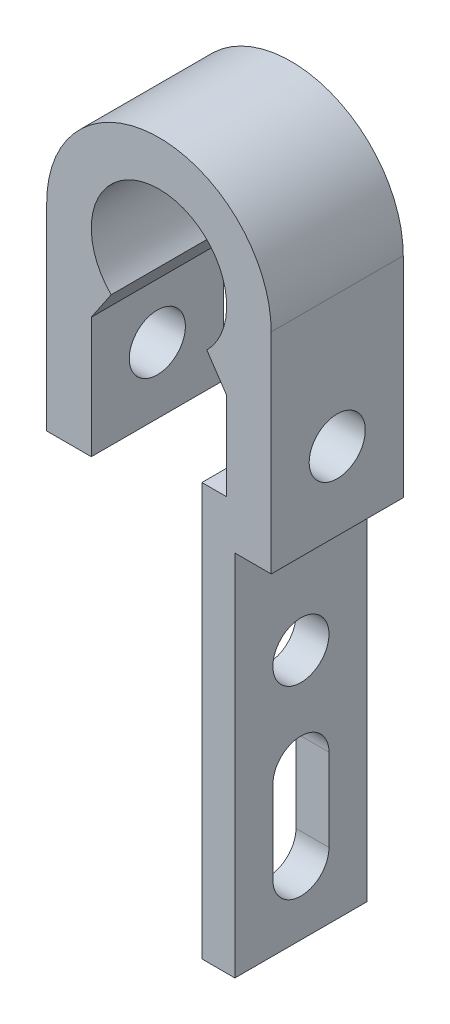
from build123d import *

# Parameters (mm, degrees)
RESSALTO_EXTRUS_O1_DEPTH = 8
ESBO_O2_R                = 1.7
CORTE_EXTRUS_O1_DEPTH    = 39.392186705


with BuildPart() as part:
    # Esboço1 → Ressalto-extrusão1 (new body)
    with BuildSketch(Plane.XY):
        with BuildLine():
            Line((4.1, -4.676945082), (2.899137803, -2.899137803))
            ThreePointArc((2.899137803, -2.899137803), (0, 4.1), (-2.899137803, -2.899137803))
            Line((-2.899137803, -2.899137803), (-4.1, -4.676945082))
            Line((-4.1, -4.676945082), (-4.1, -12))
            Line((-4.1, -12), (-6.8, -12))
            Line((-6.8, -12), (-6.8, 0))
            ThreePointArc((-6.8, 0), (0, 6.8), (6.8, 0))
            Line((6.8, 0), (6.8, -12.7))
            Line((6.8, -12.7), (4.6, -12.7))
            Line((4.6, -12.7), (4.6, -35))
            Line((4.6, -35), (2.6, -35))
            Line((2.6, -35), (2.6, -10))
            Line((2.6, -10), (4.1, -10))
            Line((4.1, -10), (4.1, -4.676945082))
        make_face()
    extrude(amount=RESSALTO_EXTRUS_O1_DEPTH)

    # Esboço2 → Corte-extrusão1 (cut, through all)
    with BuildSketch(Plane.ZY.offset(6.8)):
        with Locations((4, -8)):
            Circle(ESBO_O2_R)
        with Locations(Location((4, -19.8, 0), (0, 0, 270))):
            Circle(ESBO_O2_R)
        with BuildLine():
            Line((5.7, -26), (5.7, -31))
            ThreePointArc((5.7, -31), (4, -32.7), (2.3, -31))
            Line((2.3, -31), (2.3, -26))
            ThreePointArc((2.3, -26), (4, -24.3), (5.7, -26))
        make_face()
    extrude(amount=-CORTE_EXTRUS_O1_DEPTH, mode=Mode.SUBTRACT)


solid = part.part
